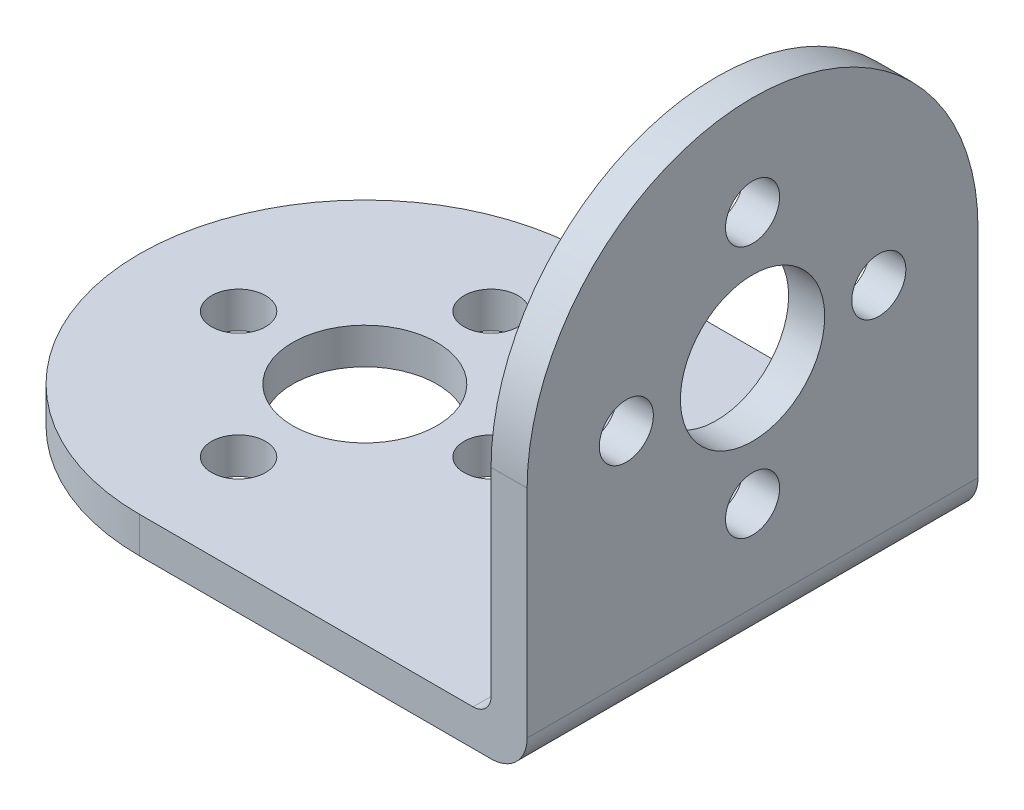
from build123d import *

# Parameters (mm, degrees)
SKETCH1_R           = 4
SKETCH1_R_2         = 1.5
BOSS_EXTRUDE1_DEPTH = 2
SKETCH2_R           = 4
SKETCH2_R_2         = 1.5
BOSS_EXTRUDE2_DEPTH = 2
FILLET1_R           = 1
FILLET3_R           = 2


with BuildPart() as part:
    # Sketch1 → Boss-Extrude1 (new body)
    with BuildSketch(Plane(origin=(0, 0, 0), x_dir=(1, 0, 0), z_dir=(0, 1, 0))):
        with BuildLine():
            Line((0, 12.5), (0, -12.5))
            Line((0, -12.5), (-19.5, -12.5))
            ThreePointArc((-19.5, -12.5), (-32, 0), (-19.5, 12.5))
            Line((-19.5, 12.5), (0, 12.5))
        make_face()
        with Locations(Location((-19.5, 0, 0), (0, 0, 270))):
            Circle(SKETCH1_R, mode=Mode.SUBTRACT)
        with Locations(Location((-19.5, 7, 0), (0, 0, 270))):
            Circle(SKETCH1_R_2, mode=Mode.SUBTRACT)
        with Locations(Location((-19.5, -7, 0), (0, 0, 270))):
            Circle(SKETCH1_R_2, mode=Mode.SUBTRACT)
        with Locations(Location((-12.5, 0, 0), (0, 0, 270))):
            Circle(SKETCH1_R_2, mode=Mode.SUBTRACT)
        with Locations(Location((-26.5, 0, 0), (0, 0, 270))):
            Circle(SKETCH1_R_2, mode=Mode.SUBTRACT)
    extrude(amount=BOSS_EXTRUDE1_DEPTH)

    # Sketch2 → Boss-Extrude2 (add)
    with BuildSketch(Plane(origin=(0, 0, 0), x_dir=(0, 0, -1), z_dir=(1, 0, 0))):
        with BuildLine():
            Line((-12.5, 0), (12.5, 0))
            Line((12.5, 0), (12.5, 14))
            ThreePointArc((12.5, 14), (0, 26.5), (-12.5, 14))
            Line((-12.5, 14), (-12.5, 0))
        make_face()
        with Locations((0, 14)):
            Circle(SKETCH2_R, mode=Mode.SUBTRACT)
        with Locations((0, 21)):
            Circle(SKETCH2_R_2, mode=Mode.SUBTRACT)
        with Locations((7, 14)):
            Circle(SKETCH2_R_2, mode=Mode.SUBTRACT)
        with Locations((0, 7)):
            Circle(SKETCH2_R_2, mode=Mode.SUBTRACT)
        with Locations((-7, 14)):
            Circle(SKETCH2_R_2, mode=Mode.SUBTRACT)
    extrude(amount=BOSS_EXTRUDE2_DEPTH)

    # Fillet1
    fillet1_edges = [part.edges().sort_by_distance(p)[0] for p in [
        (0, 2, 0),
    ]]
    fillet(fillet1_edges, radius=FILLET1_R)

    # Fillet3
    fillet3_edges = [part.edges().sort_by_distance(p)[0] for p in [
        (2, 0, 0),
    ]]
    fillet(fillet3_edges, radius=FILLET3_R)


solid = part.part
